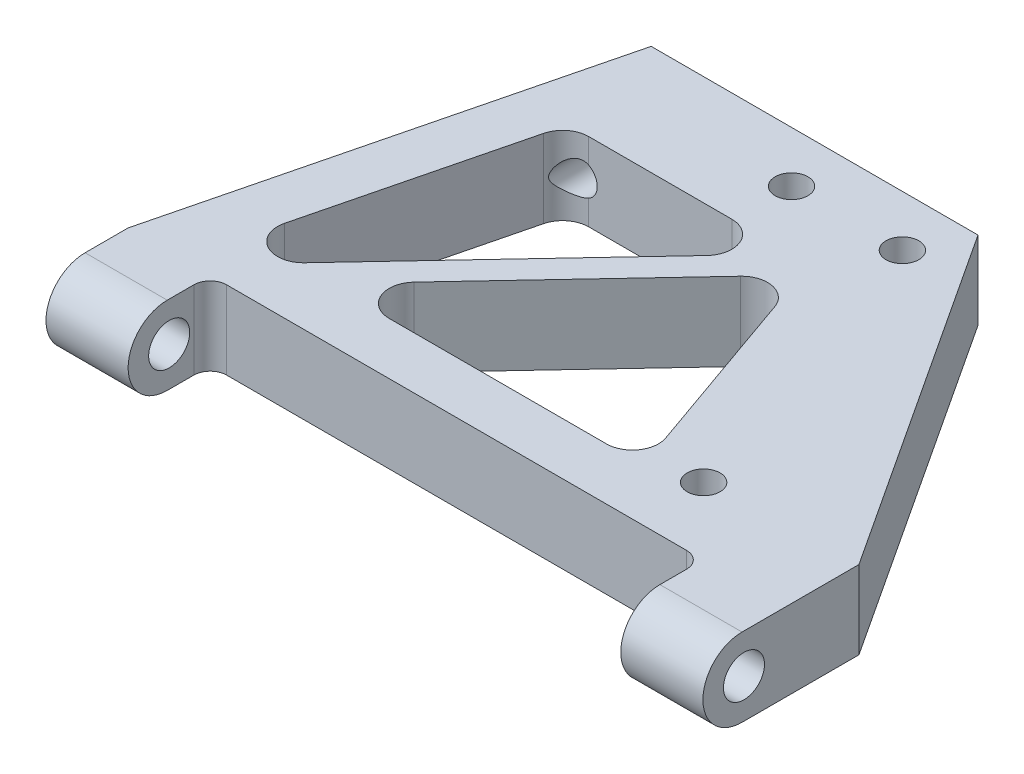
from build123d import *

# Parameters (mm, degrees)
BOSS_EXTRUDE1_DEPTH = 19.05
SKETCH7_R           = 3.96875
CUT_EXTRUDE7_DEPTH  = 38.1
FILLET6_RADIUS      = 9.525
FILLET6_LENGTH      = 20
FILLET7_RADIUS      = 9.525
FILLET7_LENGTH      = 20
SKETCH27_R          = 5
CUT_EXTRUDE16_DEPTH = 203.106166408
SKETCH30_R          = 4
CUT_EXTRUDE17_DEPTH = 203.106166408
SKETCH31_R          = 4
CUT_EXTRUDE18_DEPTH = 203.106166408
CUT_EXTRUDE19_DEPTH = 203.106166408


with BuildPart() as part:
    # Sketch1 → Boss-Extrude1 (new body)
    with BuildSketch(Plane(origin=(0, 0, 0), x_dir=(1, 0, 0), z_dir=(0, 1, 0))):
        with BuildLine():
            Line((0, -122), (20, -122))
            Line((20, -122), (20, -106))
            ThreePointArc((20, -106), (21.171572875, -103.171572875), (24, -102))
            Line((24, -102), (136, -102))
            ThreePointArc((136, -102), (138.828427125, -103.171572875), (140, -106))
            Line((140, -106), (140, -122))
            Line((140, -122), (160, -122))
            Line((160, -122), (160, -84))
            Line((160, -84), (105, 0))
            Line((105, 0), (25.4, 0))
            Line((25.4, 0), (0, -102))
            Line((0, -102), (0, -122))
        make_face()
    extrude(amount=BOSS_EXTRUDE1_DEPTH)

    # Sketch7 → Cut-Extrude7 (cut)
    with BuildSketch(Plane(origin=(0, 0, 0), x_dir=(-1, 0, 0), z_dir=(0, 0, -1))):
        with Locations((-34.925, 9.525)):
            Circle(SKETCH7_R)
    extrude(amount=-CUT_EXTRUDE7_DEPTH, mode=Mode.SUBTRACT)

    # Fillet6: full round fillet: the end face becomes a half cylinder, R = half its width
    fillet6_face = Plane((10, 9.525, 122), x_dir=(1, 0, 0), z_dir=(0, 0, 1))  # on the end face: x along it, z out of the body
    fillet6_slab = fillet6_face.offset(-FILLET6_RADIUS / 2) * Box(FILLET6_LENGTH, 2 * FILLET6_RADIUS, FILLET6_RADIUS, mode=Mode.PRIVATE)  # the body's end, R deep
    fillet6_round = Plane((10, 9.525, 112.475), x_dir=(0, 0, 1), z_dir=(1, 0, 0)) * Cylinder(FILLET6_RADIUS, FILLET6_LENGTH, mode=Mode.PRIVATE)  # its axis R under the face
    add(fillet6_slab - fillet6_round, mode=Mode.SUBTRACT)

    # Fillet7: full round fillet: the end face becomes a half cylinder, R = half its width
    fillet7_face = Plane((150, 9.525, 122), x_dir=(1, 0, 0), z_dir=(0, 0, 1))  # on the end face: x along it, z out of the body
    fillet7_slab = fillet7_face.offset(-FILLET7_RADIUS / 2) * Box(FILLET7_LENGTH, 2 * FILLET7_RADIUS, FILLET7_RADIUS, mode=Mode.PRIVATE)  # the body's end, R deep
    fillet7_round = Plane((150, 9.525, 112.475), x_dir=(0, 0, 1), z_dir=(1, 0, 0)) * Cylinder(FILLET7_RADIUS, FILLET7_LENGTH, mode=Mode.PRIVATE)  # its axis R under the face
    add(fillet7_slab - fillet7_round, mode=Mode.SUBTRACT)

    # Sketch27 → Cut-Extrude16 (cut, through all)
    with BuildSketch(Plane.ZY):
        with Locations((112, 9.525)):
            Circle(SKETCH27_R)
    extrude(amount=-CUT_EXTRUDE16_DEPTH, mode=Mode.SUBTRACT)

    # Sketch30 → Cut-Extrude17 (cut, through all)
    with BuildSketch(Plane.XZ):
        with Locations(Location((72, 12.414156832, 0), (0, 0, 270))):
            Circle(SKETCH30_R)
        with Locations(Location((99, 12.414156832, 0), (0, 0, 270))):
            Circle(SKETCH30_R)
    extrude(amount=-CUT_EXTRUDE17_DEPTH, mode=Mode.SUBTRACT)

    # Sketch31 → Cut-Extrude18 (cut, through all)
    with BuildSketch(Plane(origin=(0, 19.05, 0), x_dir=(1, 0, 0), z_dir=(0, 1, 0))):
        with Locations(Location((123.750569229, -85.577337428, 0), (0, 0, 270))):
            Circle(SKETCH31_R)
    extrude(amount=-CUT_EXTRUDE18_DEPTH, mode=Mode.SUBTRACT)

    # Sketch32 → Cut-Extrude19 (cut, through all)
    with BuildSketch(Plane(origin=(0, 19.05, 0), x_dir=(1, 0, 0), z_dir=(0, 1, 0))):
        with BuildLine():
            ThreePointArc((71.677934079, -26.634288881), (77.505742976, -30.462554664), (76.306653797, -37.331409051))
            Line((76.306653797, -37.331409051), (28.868492384, -87.842539296))
            ThreePointArc((28.868492384, -87.842539296), (21.20074064, -89.070971505), (18.077949002, -81.961004213))
            Line((18.077949002, -81.961004213), (30.656210847, -31.449873968))
            ThreePointArc((30.656210847, -31.449873968), (32.907857706, -27.980988236), (36.818034512, -26.634288881))
            Line((36.818034512, -26.634288881), (71.677934079, -26.634288881))
        make_face()
        with BuildLine():
            Line((109.779898668, -80.842599107), (95.362721275, -39.863015693))
            ThreePointArc((95.362721275, -39.863015693), (90.683122858, -35.757118611), (84.74389626, -37.623296415))
            Line((84.74389626, -37.623296415), (46.257406585, -78.60287983))
            ThreePointArc((46.257406585, -78.60287983), (45.058317405, -85.471734217), (50.886126302, -89.3))
            Line((50.886126302, -89.3), (103.789793371, -89.3))
            ThreePointArc((103.789793371, -89.3), (108.971708831, -86.620184214), (109.779898668, -80.842599107))
        make_face()
    extrude(amount=-CUT_EXTRUDE19_DEPTH, mode=Mode.SUBTRACT)


solid = part.part
